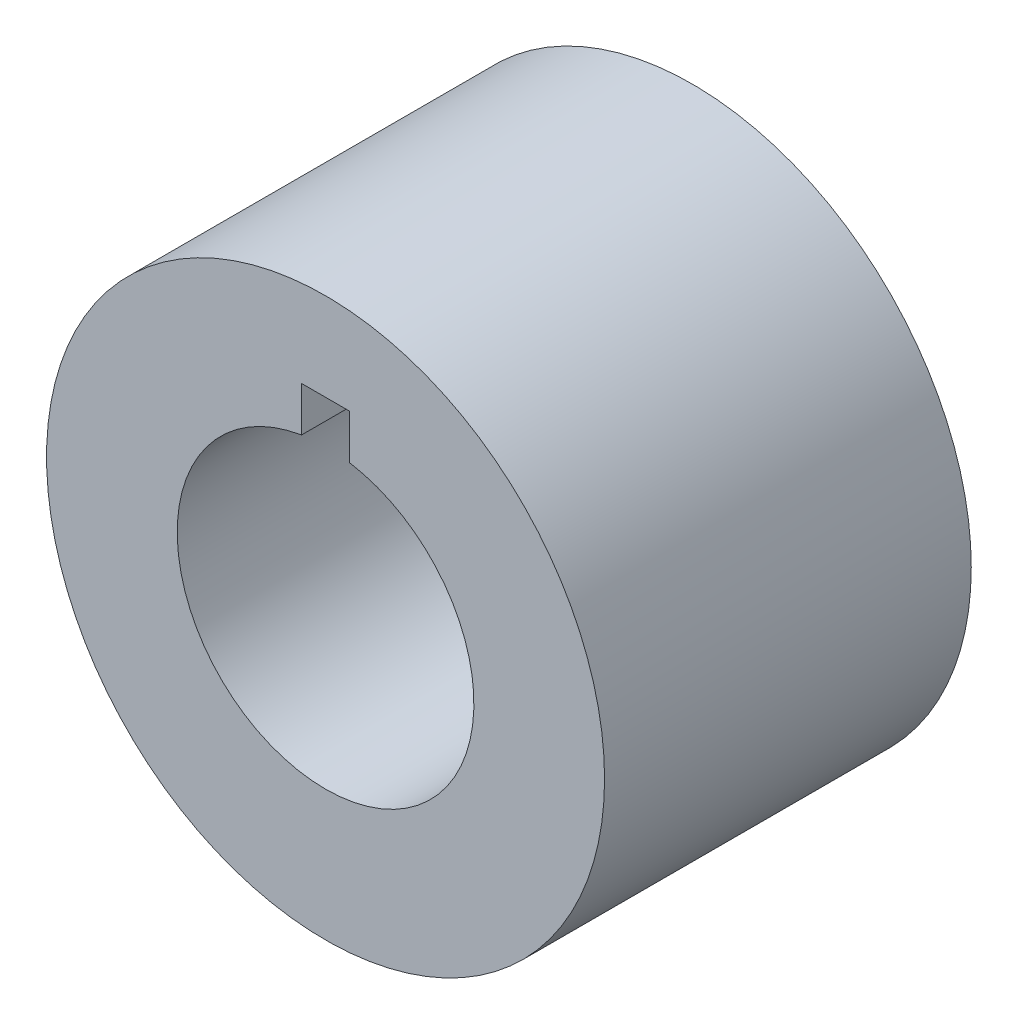
from build123d import *

# Parameters (mm, degrees)
SKETCH1_R           = 25.781
BOSS_EXTRUDE1_DEPTH = 33.8836


with BuildPart() as part:
    # Sketch1 → Boss-Extrude1 (new body)
    with BuildSketch(Plane.XY):
        Circle(SKETCH1_R)
        with BuildLine():
            Line((-2.2225, 17.653), (2.2225, 17.653))
            Line((2.2225, 17.653), (2.2225, 13.5255))
            ThreePointArc((2.2225, 13.5255), (0, -13.706883544), (-2.2225, 13.5255))
            Line((-2.2225, 13.5255), (-2.2225, 17.653))
        make_face(mode=Mode.SUBTRACT)
    extrude(amount=BOSS_EXTRUDE1_DEPTH)


solid = part.part
